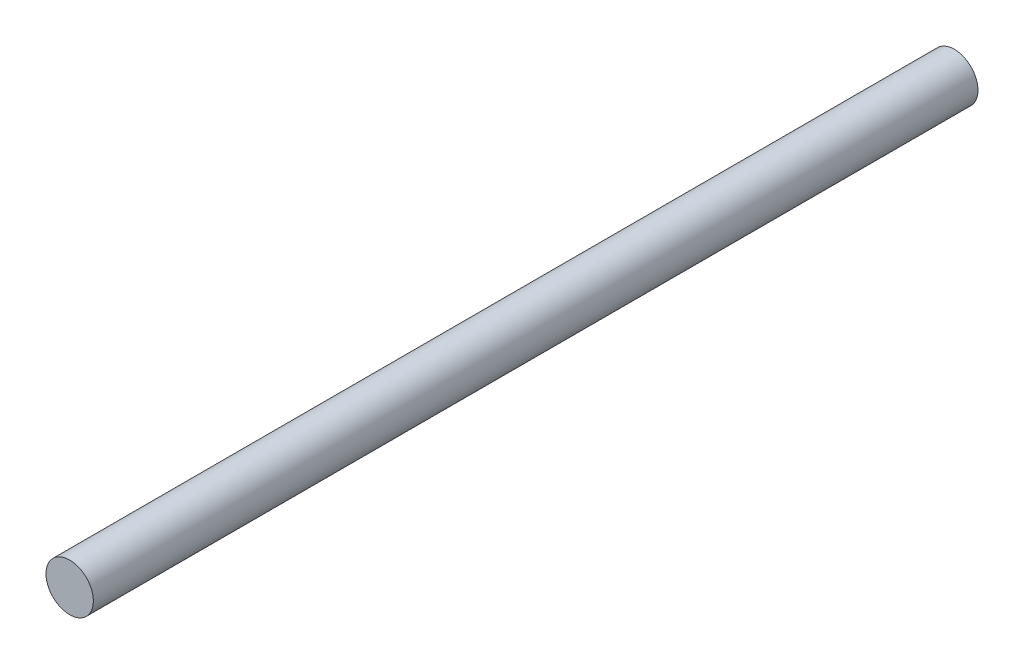
from build123d import *

# Parameters (mm, degrees)
SKETCH1_R           = 28.575
BOSS_EXTRUDE1_DEPTH = 1066.8


with BuildPart() as part:
    # Sketch1 → Boss-Extrude1 (new body)
    with BuildSketch(Plane.XY):
        Circle(SKETCH1_R)
    extrude(amount=BOSS_EXTRUDE1_DEPTH)


solid = part.part
